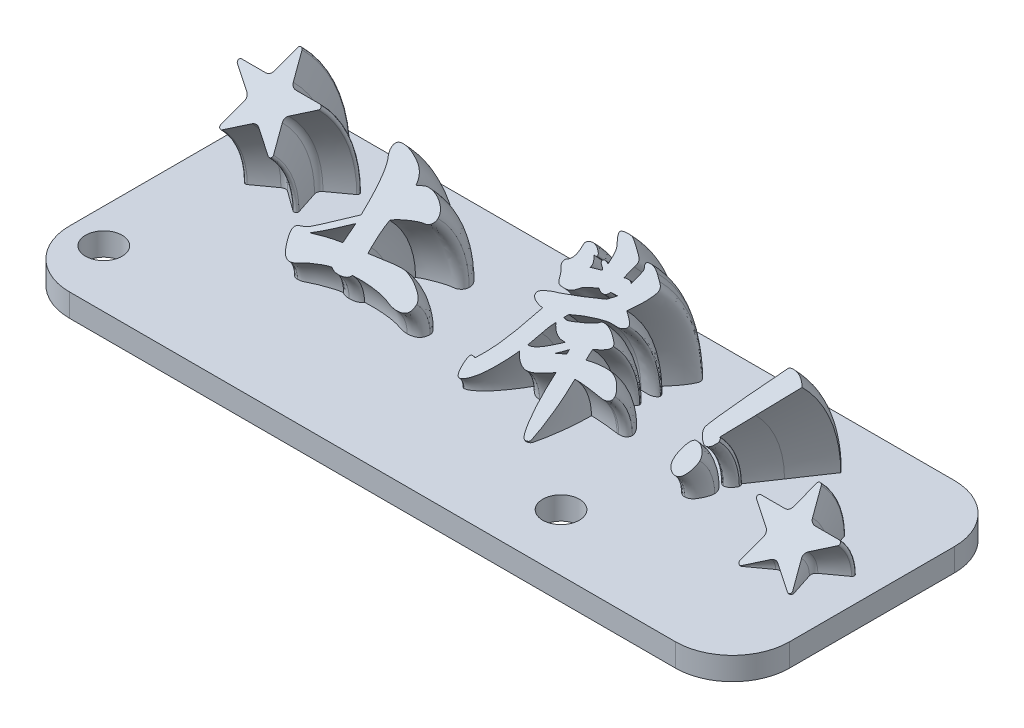
from build123d import *

# Parameters (mm, degrees)
SKETCH_1_W      = 63
SKETCH_1_H      = 24.41971005
SKETCH_1_R      = 1.6
EXTRUDE_1_DEPTH = 2
FILLET_1_R      = 5


with BuildPart() as part:
    # 草图1 → 凸台-拉伸1 (new body)
    with BuildSketch(Plane(origin=(0, 0, 0), x_dir=(1, 0, 0), z_dir=(0, 1, 0))):
        with Locations((14.983849876, -22.209855025)):
            Rectangle(SKETCH_1_W, SKETCH_1_H)
        with Locations(Location((-13.516150124, -29.41971005, 0), (0, 0, 270))):
            Circle(SKETCH_1_R, mode=Mode.SUBTRACT)
        with Locations(Location((26.483849876, -29.41971005, 0), (0, 0, 270))):
            Circle(SKETCH_1_R, mode=Mode.SUBTRACT)
    extrude(amount=EXTRUDE_1_DEPTH)

    # 扫描3: sweep along a path in 草图3
    with BuildLine(Plane(origin=(0, 0, 0), x_dir=(0, 0, -1), z_dir=(1, 0, 0))) as sweep_3_path:
        ThreePointArc((-10.91971005, 2), (-12.061517062, 7.740251485), (-15.313108332, 12.606601718))
    # 草图2 → 扫描3 (sweep)
    # profile 1 of 6: a face of its own
    with BuildSketch(Plane(origin=(0, 2, 0), x_dir=(1, 0, 0), z_dir=(0, 1, 0))):
        with BuildLine():
            Line((-12.181116617, -18.291213265), (-11.528669886, -16.283188703))
            ThreePointArc((-11.528669886, -16.283188703), (-11.528669886, -15.974171709), (-11.710305518, -15.724171709))
            Line((-11.710305518, -15.724171709), (-13.418433235, -14.483144279))
            ThreePointArc((-13.418433235, -14.483144279), (-13.491087488, -14.259537482), (-13.300876184, -14.121340881))
            Line((-13.300876184, -14.121340881), (-11.189514212, -14.121340881))
            ThreePointArc((-11.189514212, -14.121340881), (-10.895621586, -14.025849378), (-10.713985954, -13.775849378))
            Line((-10.713985954, -13.775849378), (-10.061539223, -11.767824816))
            ThreePointArc((-10.061539223, -11.767824816), (-9.87132792, -11.629628215), (-9.681116617, -11.767824816))
            Line((-9.681116617, -11.767824816), (-9.028669886, -13.775849378))
            ThreePointArc((-9.028669886, -13.775849378), (-8.847034254, -14.025849378), (-8.553141628, -14.121340881))
            Line((-8.553141628, -14.121340881), (-6.441779655, -14.121340881))
            ThreePointArc((-6.441779655, -14.121340881), (-6.251568352, -14.259537482), (-6.324222605, -14.483144279))
            Line((-6.324222605, -14.483144279), (-8.032350322, -15.724171709))
            ThreePointArc((-8.032350322, -15.724171709), (-8.213985954, -15.974171709), (-8.213985954, -16.283188703))
            Line((-8.213985954, -16.283188703), (-7.561539223, -18.291213265))
            ThreePointArc((-7.561539223, -18.291213265), (-7.634193476, -18.514820063), (-7.869307577, -18.514820063))
            Line((-7.869307577, -18.514820063), (-9.577435294, -17.273792634))
            ThreePointArc((-9.577435294, -17.273792634), (-9.87132792, -17.178301131), (-10.165220546, -17.273792634))
            Line((-10.165220546, -17.273792634), (-11.873348263, -18.514820063))
            ThreePointArc((-11.873348263, -18.514820063), (-12.108462364, -18.514820063), (-12.181116617, -18.291213265))
        make_face()
    # profile 2 of 6: a face of its own
    with BuildSketch(Plane(origin=(0, 2, 0), x_dir=(1, 0, 0), z_dir=(0, 1, 0))):
        with BuildLine():
            Line((22.091305848, -12.754817597), (22.548752657, -13.125030363))
            add(Edge.make_bspline(
                [(22.548752657, -13.125030363), (22.636654759, -13.195519199), (22.766563315, -13.29916809), (22.856934675, -13.480230515), (22.882961785, -13.612227973), (22.853142594, -13.760703594), (22.785567516, -13.935967708), (22.676609943, -14.148681957), (22.527450722, -14.397564759), (22.337237862, -14.681525565), (22.002537346, -15.125993706), (21.723446786, -15.469859045), (21.516837763, -15.703753767)],
                knots=[0, 0, 0, 0, 0.110126605, 0.153371671, 0.192108736, 0.236891976, 0.296350469, 0.37248426, 0.465912553, 0.574887644, 0.700458096, 1, 1, 1, 1], degree=3))
            add(Edge.make_bspline(
                [(21.516837763, -15.703753767), (21.623503315, -15.784597402), (21.773056818, -15.901070563), (21.952953682, -16.056053802), (22.053020221, -16.159271105), (22.133338608, -16.250624228), (22.205301615, -16.351116298), (22.237993014, -16.429683131), (22.238114359, -16.480349512)],
                knots=[0, 0, 0, 0, 0.371009584, 0.525656366, 0.657756634, 0.769305216, 0.862579579, 1, 1, 1, 1], degree=3))
            add(Edge.make_bspline(
                [(22.238114359, -16.480349512), (22.237580177, -16.53146243), (22.199090885, -16.608896689), (22.107473516, -16.690524496), (22.010128759, -16.752546088), (21.894515023, -16.808573158), (21.761792339, -16.84464893), (21.617142273, -16.870230125), (21.336991086, -16.87034432), (21.106478154, -16.859156989), (20.927476061, -16.861200576)],
                knots=[0, 0, 0, 0, 0.101429238, 0.168992905, 0.248462432, 0.33649523, 0.429917157, 0.528167805, 0.635288959, 1, 1, 1, 1], degree=3))
            add(Edge.make_bspline(
                [(20.927476061, -16.861200576), (20.84904701, -16.860791094), (20.722794143, -16.87431188), (20.541689616, -16.896600958), (20.378416985, -16.928693575), (20.195405821, -16.962840302), (19.995490244, -17.012020673), (19.776542337, -17.063840828), (19.466292463, -17.14586895), (19.080595941, -17.253802462), (18.509846159, -17.434087095), (18.103598545, -17.587891947), (17.846624997, -17.697370789)],
                knots=[0, 0, 0, 0, 0.073275516, 0.118825889, 0.17079738, 0.229012267, 0.293121427, 0.363506301, 0.439691932, 0.593575122, 0.738487947, 1, 1, 1, 1], degree=3))
            add(Edge.make_bspline(
                [(17.846624997, -17.697370789), (17.770706456, -17.804779182), (17.698995027, -17.91501391), (17.626299799, -18.024589214)],
                knots=[0, 0, 0, 0, 0.185269975, 0.185269975, 0.185269975, 0.185269975], degree=3))
            add(Edge.make_bspline(
                [(17.626299799, -18.024589214), (17.644281987, -18.02358186), (17.661518614, -18.022902703)],
                knots=[0.983400778, 0.983400778, 0.983400778, 1, 1, 1], degree=2))
            Line((17.661518614, -18.022902703), (17.859390955, -18.065455895))
            add(Edge.make_bspline(
                [(17.859390955, -18.065455895), (17.922472771, -18.06378806), (18.026550543, -18.047662863), (18.17740703, -18.014041892), (18.319603963, -17.972479573), (18.481863569, -17.920873565), (18.664708442, -17.859940167), (18.86677006, -17.783942489), (19.083057543, -17.702693659), (19.296794267, -17.615655628), (19.49475597, -17.532850612), (19.669830954, -17.456806367), (19.820360106, -17.385223582), (19.946734552, -17.318073096), (20.073653891, -17.248670518), (20.151481042, -17.189489542), (20.193433508, -17.150562278)],
                knots=[0, 0, 0, 0, 0.074782481, 0.124859091, 0.183531506, 0.250677228, 0.327139576, 0.412434862, 0.507097542, 0.601591364, 0.686553139, 0.762001582, 0.828323007, 0.884473345, 0.932019765, 1, 1, 1, 1], degree=3))
            add(Edge.make_bspline(
                [(20.193433508, -17.150562278), (20.317768429, -17.049770953), (20.478539891, -17.054817597)],
                knots=[0, 0, 0, 1, 1, 1], degree=2))
            add(Edge.make_bspline(
                [(20.478539891, -17.054817597), (20.647104926, -17.051991779), (20.903199954, -17.112912149), (21.228341174, -17.271906024), (21.428565294, -17.412373726), (21.584157971, -17.533852312), (21.686981178, -17.622778302), (21.776288915, -17.70314609), (21.846450217, -17.780239575), (21.902239963, -17.850375356), (21.954473695, -17.928438107), (21.974091898, -17.990583107), (21.976412231, -18.029285682)],
                knots=[0, 0, 0, 0, 0.267581639, 0.415335096, 0.577184528, 0.658037541, 0.731305499, 0.794770106, 0.850213624, 0.897909293, 0.938224058, 1, 1, 1, 1], degree=3))
            add(Edge.make_bspline(
                [(21.976412231, -18.029285682), (21.975602774, -18.096574855), (21.917100795, -18.193684463), (21.798833756, -18.309036491), (21.661375316, -18.406446857), (21.486567414, -18.506561605), (21.182204327, -18.659925022), (20.927711224, -18.760583366), (20.746624997, -18.831413342)],
                knots=[0, 0, 0, 0, 0.127558201, 0.216833012, 0.326261833, 0.459551721, 0.615138123, 1, 1, 1, 1], degree=3))
            add(Edge.make_bspline(
                [(20.746624997, -18.831413342), (20.729537527, -18.928481732), (20.710002013, -19.188192824), (20.70500225, -19.448337123), (20.706199465, -19.610136746)],
                knots=[0, 0, 0, 0, 0.378279263, 1, 1, 1, 1], degree=3))
            add(Edge.make_bspline(
                [(20.706199465, -19.610136746), (20.990542604, -19.546590225), (21.414444073, -19.48138766), (21.974265124, -19.429166824), (22.308923323, -19.420857218), (22.566541777, -19.425228191), (22.745670934, -19.450206884), (22.914417923, -19.485161368), (23.070389118, -19.538366648), (23.215331754, -19.605051827), (23.348775549, -19.685546096), (23.467839012, -19.784969961), (23.606566657, -19.927880391), (23.747908676, -20.108179222), (23.908684519, -20.360469753), (23.980865444, -20.554173856), (23.98279521, -20.678221852)],
                knots=[0, 0, 0, 0, 0.223305433, 0.328703138, 0.431010523, 0.479997342, 0.526083135, 0.569510907, 0.612001824, 0.652161837, 0.691720474, 0.731144225, 0.770766398, 0.844340706, 0.906387243, 1, 1, 1, 1], degree=3))
            add(Edge.make_bspline(
                [(23.98279521, -20.678221852), (23.982613435, -20.75434176), (23.967050725, -20.868634741), (23.890114278, -20.993483555), (23.815116355, -21.068946067), (23.716861585, -21.126195957), (23.547275646, -21.182743868), (23.405064269, -21.191699677), (23.306199465, -21.193115469)],
                knots=[0, 0, 0, 0, 0.238234253, 0.343709532, 0.44932194, 0.564588411, 0.692398315, 1, 1, 1, 1], degree=3))
            add(Edge.make_bspline(
                [(23.306199465, -21.193115469), (23.221576785, -21.19218932), (23.138114359, -21.178221852)],
                knots=[0, 0, 0, 1, 1, 1], degree=2))
            add(Edge.make_bspline(
                [(23.138114359, -21.178221852), (22.975549397, -21.146232865), (22.700544337, -21.113685271), (22.296586276, -21.06877213), (21.927628594, -21.035328758), (21.558227452, -21.003867324), (21.149113694, -20.977379904), (20.868710307, -20.968078567), (20.699816487, -20.971838874)],
                knots=[0, 0, 0, 0, 0.20275136, 0.339071354, 0.497863557, 0.656503611, 0.793166396, 1, 1, 1, 1], degree=3))
            add(Edge.make_bspline(
                [(20.699816487, -20.971838874), (20.696870644, -21.285402165), (20.686301385, -21.742565715), (20.650394646, -22.333083353), (20.619360678, -22.743332418), (20.573837823, -23.148708728), (20.524909741, -23.567067863), (20.456763511, -24.004140809), (20.395731919, -24.376936833), (20.347185925, -24.67020228), (20.307386279, -24.868961568), (20.273385525, -25.044845384), (20.245056263, -25.198644448), (20.21461487, -25.328899269), (20.187524678, -25.435986752), (20.163921994, -25.520574924), (20.138657096, -25.600700246), (20.091718155, -25.678739187), (19.96813795, -25.770781119), (19.844717084, -25.782259409), (19.763646274, -25.784604831)],
                knots=[0, 0, 0, 0, 0.183984559, 0.268181079, 0.347067651, 0.425318523, 0.507479492, 0.594157246, 0.684792239, 0.72911804, 0.768531687, 0.803702217, 0.834221122, 0.860261937, 0.882160604, 0.899020868, 0.911784451, 0.931410949, 0.951300313, 1, 1, 1, 1], degree=3))
            add(Edge.make_bspline(
                [(19.763646274, -25.784604831), (19.710224662, -25.785291315), (19.630565063, -25.743768657), (19.55275618, -25.643786226), (19.493934175, -25.536578354), (19.441403139, -25.399579648), (19.393278052, -25.232905539), (19.349831731, -25.035870875), (19.296022907, -24.73274755), (19.246269721, -24.328746138), (19.198287567, -23.83147906), (19.170542393, -23.32394253), (19.164448293, -22.818665246), (19.166421934, -22.337751817), (19.177278762, -21.800679031), (19.19034738, -21.427497631), (19.208327125, -21.199498448)],
                knots=[0, 0, 0, 0, 0.032670432, 0.053646159, 0.079297049, 0.109635706, 0.1460356, 0.188711511, 0.236914469, 0.340293257, 0.445496153, 0.5521864, 0.660970635, 0.764369771, 0.855699989, 1, 1, 1, 1], degree=3))
            add(Edge.make_bspline(
                [(19.208327125, -21.199498448), (18.996505427, -21.320546702), (18.693681444, -21.498003724), (18.290590459, -21.689891367), (18.028010299, -21.807172357), (17.786404042, -21.894100543), (17.514425851, -21.976558398), (17.317236418, -22.009560463), (17.193433508, -22.010136746)],
                knots=[0, 0, 0, 0, 0.33427401, 0.479765057, 0.611093469, 0.727817969, 0.83105706, 1, 1, 1, 1], degree=3))
            add(Edge.make_bspline(
                [(17.193433508, -22.010136746), (17.044378813, -22.011442926), (16.819744232, -21.958184852), (16.547308674, -21.804297983), (16.361111404, -21.645141134), (16.198790879, -21.476250939), (16.078654855, -21.318352663), (16.02263732, -21.214198904), (16.005462488, -21.168476155)],
                knots=[0, 0, 0, 0, 0.26487199, 0.404536003, 0.555847981, 0.701142983, 0.822619503, 0.910137352, 0.910137352, 0.910137352, 0.910137352], degree=3))
            add(Edge.make_bspline(
                [(16.005462488, -21.168476155), (15.933195988, -21.298356507), (15.734378794, -21.64231384), (15.460587706, -22.081246459), (15.189929912, -22.479517996), (14.993913369, -22.75546415), (14.807959991, -23.012197581), (14.625020377, -23.243273189), (14.44919086, -23.452127218), (14.284987506, -23.643120153), (14.123396322, -23.808289825), (13.969330575, -23.951620062), (13.824309144, -24.075624004), (13.68759143, -24.182237649), (13.560997284, -24.273850186), (13.443910655, -24.348601084), (13.336714791, -24.408413168), (13.212373201, -24.457811786), (13.12167446, -24.48248118), (13.063646274, -24.482477171)],
                knots=[0.285582836, 0.285582836, 0.285582836, 0.285582836, 0.355951056, 0.473628688, 0.530443117, 0.583923532, 0.633894059, 0.68051764, 0.723427035, 0.763166997, 0.799737274, 0.832764073, 0.862776763, 0.890049343, 0.914837504, 0.936729248, 0.955811073, 0.972834715, 1, 1, 1, 1], degree=3))
            add(Edge.make_bspline(
                [(13.063646274, -24.482477171), (13.017589254, -24.485706543), (12.949421468, -24.455084847), (12.888250075, -24.374949174), (12.847595015, -24.292929921), (12.820447598, -24.186353168), (12.785358195, -24.001432627), (12.784780928, -23.848199512), (12.78279521, -23.73992398)],
                knots=[0, 0, 0, 0, 0.155982349, 0.241795894, 0.346475975, 0.472038898, 0.622337617, 1, 1, 1, 1], degree=3))
            add(Edge.make_bspline(
                [(12.78279521, -23.73992398), (12.785015902, -23.613239378), (12.784950653, -23.434618891), (12.820786258, -23.217866625), (12.846717311, -23.093472595), (12.888284535, -22.997787298), (12.946149479, -22.905794606), (13.015354562, -22.866392132), (13.063646274, -22.869711214)],
                knots=[0, 0, 0, 0, 0.388213482, 0.541688272, 0.670919341, 0.774725337, 0.858834364, 1, 1, 1, 1], degree=3))
            add(Edge.make_bspline(
                [(13.063646274, -22.869711214), (13.133104962, -22.873785444), (13.224157041, -22.871808419), (13.314999062, -22.905685827), (13.333200934, -22.921698663), (13.334916387, -22.923324956)],
                knots=[0, 0, 0, 0, 0.396090859, 0.521279296, 0.534791128, 0.534791128, 0.534791128, 0.534791128], degree=3))
            add(Edge.make_bspline(
                [(13.334916387, -22.923324956), (13.343899124, -22.912633225), (13.383857302, -22.864098926), (13.458491727, -22.763617569), (13.569817464, -22.614609101), (13.701722748, -22.432525164), (13.849619536, -22.21378657), (14.022212084, -21.962422574), (14.211874426, -21.66773749), (14.407210458, -21.318994645), (14.620441021, -20.920562836), (14.84804803, -20.469984733), (15.085462794, -19.96481852), (15.433367315, -19.188821605), (15.696833685, -18.578750233), (15.872156912, -18.152689937)],
                knots=[0.031545124, 0.031545124, 0.031545124, 0.031545124, 0.039044058, 0.065343187, 0.098482233, 0.138772681, 0.185786055, 0.239964126, 0.30216394, 0.373482291, 0.454071252, 0.544317996, 0.643936129, 0.75313668, 1, 1, 1, 1], degree=3))
            add(Edge.make_bspline(
                [(15.872156912, -18.152689937), (15.724027515, -18.130139047), (15.513972892, -18.099242793), (15.264400547, -18.01529276), (15.120108154, -17.953497949), (15.006284305, -17.881610071), (14.900259995, -17.775590413), (14.857790763, -17.674672855), (14.861518614, -17.605881427)],
                knots=[0, 0, 0, 0, 0.365187915, 0.512324759, 0.638830944, 0.745896882, 0.837296112, 1, 1, 1, 1], degree=3))
            add(Edge.make_bspline(
                [(14.861518614, -17.605881427), (14.863662049, -17.516097602), (14.947784843, -17.387204381), (15.132931003, -17.264134231), (15.32713561, -17.168795832), (15.54302298, -17.083527837), (15.756264035, -17.005847711), (15.956907472, -16.943254321), (16.122961589, -16.905429461), (16.262660486, -16.875092559), (16.389651156, -16.842365121), (16.539132387, -16.799852924), (16.712675284, -16.748034468), (16.90995063, -16.688825859), (17.130571951, -16.620897534), (17.374665049, -16.543945022), (18.255056339, -16.256235401), (19.050951791, -15.982656319), (19.748752657, -15.714392065)],
                knots=[0, 0, 0, 0, 0.048491233, 0.081972573, 0.12449083, 0.170185603, 0.21264189, 0.252319931, 0.288460003, 0.308520986, 0.332839239, 0.362305092, 0.396052274, 0.43484985, 0.478316434, 0.526072239, 0.579002596, 1, 1, 1, 1], degree=3))
            add(Edge.make_bspline(
                [(19.748752657, -15.714392065), (20.0621747, -15.460009706), (20.357263295, -15.184604831)],
                knots=[0, 0, 0, 1, 1, 1], degree=2))
            add(Edge.make_bspline(
                [(20.357263295, -15.184604831), (20.327267183, -15.191796814), (20.268270345, -15.199011718), (20.17072522, -15.199114945), (20.066506433, -15.202627295), (19.960777018, -15.200582312), (19.860763278, -15.204348508), (19.798136267, -15.20456662), (19.765773934, -15.210136746)],
                knots=[0, 0, 0, 0, 0.155970367, 0.299577126, 0.493418923, 0.683638443, 0.834421161, 1, 1, 1, 1], degree=3))
            add(Edge.make_bspline(
                [(19.765773934, -15.210136746), (19.719089889, -15.302073469), (19.626328599, -15.425314491), (19.450766019, -15.51878475), (19.311960624, -15.533471924), (19.176476641, -15.523353475), (19.006245859, -15.477283687), (18.893653869, -15.40979375), (18.829603721, -15.352689937)],
                knots=[0, 0, 0, 0, 0.279858394, 0.402462577, 0.526363878, 0.651343181, 0.768537128, 1, 1, 1, 1], degree=3))
            add(Edge.make_bspline(
                [(18.829603721, -15.352689937), (18.644251901, -15.420932637), (18.395559115, -15.524139868), (18.094824698, -15.64226773), (17.897634355, -15.72966946), (17.686116482, -15.846979521), (17.480609361, -16.038623264), (17.278372704, -16.223681465), (17.08393641, -16.329179441), (16.92284088, -16.381082207), (16.792455014, -16.409266038), (16.649040982, -16.421915554), (16.500491601, -16.429892797), (16.357746904, -16.422075544), (16.232063742, -16.410779255), (16.130914865, -16.382212574), (16.044994061, -16.346269745), (15.977678115, -16.279321086), (15.918646525, -16.186595921), (15.862087696, -16.063804328), (15.811090602, -15.918028349), (15.765555159, -15.766439372), (15.70328331, -15.634423554), (15.644675112, -15.521085823), (15.523476577, -15.373213536), (15.436289533, -15.246872756), (15.438114359, -15.127158023)],
                knots=[0, 0, 0, 0, 0.133001137, 0.181444552, 0.217586547, 0.278391937, 0.343119869, 0.406191934, 0.46262796, 0.490278001, 0.520077777, 0.552264031, 0.587172233, 0.620170975, 0.648558371, 0.671857738, 0.690879591, 0.710486505, 0.734604317, 0.764739275, 0.801314499, 0.838634248, 0.871138103, 0.899585748, 0.924144404, 1, 1, 1, 1], degree=3))
            add(Edge.make_bspline(
                [(15.438114359, -15.127158023), (15.437466259, -15.05127284), (15.457569634, -14.93809127), (15.549454555, -14.820532449), (15.645445978, -14.769971336), (15.747876698, -14.717714959), (15.838912932, -14.629966785), (15.925180532, -14.522773501), (16.00192914, -14.38799893), (16.069322711, -14.224579987), (16.132947345, -13.940772792), (16.145161453, -13.708524673), (16.144497338, -13.544179299)],
                knots=[0, 0, 0, 0, 0.124995936, 0.180308523, 0.237667531, 0.300608383, 0.368017971, 0.442370998, 0.525621772, 0.620932107, 0.73077443, 1, 1, 1, 1], degree=3))
            add(Edge.make_bspline(
                [(16.144497338, -13.544179299), (16.14371459, -13.471342009), (16.160114772, -13.36114028), (16.243307681, -13.246493134), (16.354625444, -13.165836573), (16.526292279, -13.108499642), (16.712166952, -13.084525192), (16.871291572, -13.099613026), (16.996264347, -13.141075835), (17.125375536, -13.202070078), (17.245880181, -13.29007736), (17.352827939, -13.381369636), (17.439613552, -13.463659409), (17.489294028, -13.542207662), (17.510702792, -13.611479574), (17.501497574, -13.667728447), (17.477072424, -13.711583843), (17.430879787, -13.736132367), (17.362368173, -13.741649428), (17.304192366, -13.741522123), (17.267473588, -13.728426765), (17.263159408, -13.726552499)],
                knots=[0, 0, 0, 0, 0.099839376, 0.143840496, 0.188414638, 0.283871586, 0.385395448, 0.440454492, 0.498793151, 0.562811043, 0.633167727, 0.699958167, 0.753625235, 0.794154711, 0.82491022, 0.849231699, 0.869496437, 0.890586822, 0.91680721, 0.962120541, 0.968378571, 0.968378571, 0.968378571, 0.968378571], degree=3))
            add(Edge.make_bspline(
                [(17.263159408, -13.726552499), (17.293017142, -13.775269255), (17.356192296, -13.87931104), (17.436281766, -14.033161911), (17.491075699, -14.180590234), (17.508855899, -14.302368142), (17.505841939, -14.395983224), (17.489632304, -14.461981535), (17.467463137, -14.504432353), (17.448472018, -14.516099829), (17.441764449, -14.518330616)],
                knots=[0.067600269, 0.067600269, 0.067600269, 0.067600269, 0.247993662, 0.451212436, 0.614741941, 0.741367831, 0.837725266, 0.907225464, 0.957528385, 0.979753835, 0.979753835, 0.979753835, 0.979753835], degree=3))
            add(Edge.make_bspline(
                [(17.441764449, -14.518330616), (17.47560506, -14.513448151), (17.508430914, -14.504333873), (17.540242019, -14.49098781)],
                knots=[0.16832083, 0.16832083, 0.16832083, 0.16832083, 1, 1, 1, 1], degree=3))
            add(Edge.make_bspline(
                [(17.540242019, -14.49098781), (17.948571377, -14.370009524), (18.367901593, -14.295243129)],
                knots=[0, 0, 0, 1, 1, 1], degree=2))
            add(Edge.make_bspline(
                [(18.367901593, -14.295243129), (18.353792377, -14.247269125), (18.290321586, -14.147498598), (18.194302065, -14.07934071), (18.140242019, -14.04205164)],
                knots=[0, 0, 0, 0, 0.428422857, 1, 1, 1, 1], degree=3))
            add(Edge.make_bspline(
                [(18.140242019, -14.04205164), (18.095183484, -14.009151534), (18.032831285, -13.957386165), (17.986516192, -13.867696343), (17.975453731, -13.806304665), (17.983176121, -13.747553498), (18.042661775, -13.684426239), (18.113023404, -13.679953651), (18.157263295, -13.678221852)],
                knots=[0, 0, 0, 0, 0.310300554, 0.43246365, 0.547301734, 0.650622115, 0.744603316, 1, 1, 1, 1], degree=3))
            add(Edge.make_bspline(
                [(18.157263295, -13.678221852), (18.343285391, -13.689665142), (18.508327125, -13.778221852)],
                knots=[0, 0, 0, 1, 1, 1], degree=2))
            add(Edge.make_bspline(
                [(18.508327125, -13.778221852), (18.522060343, -13.569957604), (18.528641889, -13.313857071), (18.527001939, -13.017082274), (18.518567874, -12.894154661), (18.50482296, -12.790034758), (18.481989014, -12.697999759), (18.447395447, -12.605401214), (18.391167416, -12.50232893), (18.323302774, -12.375906273), (18.232419559, -12.242419488), (18.147320412, -12.103019163), (18.084394648, -11.967373131), (18.048021993, -11.844044494), (18.030982629, -11.749540114), (18.04242539, -11.677896521), (18.080574504, -11.634289404), (18.137193011, -11.598766062), (18.216421336, -11.573327357), (18.314224233, -11.54898437), (18.488832496, -11.531148209), (18.6299118, -11.521499039), (18.73173138, -11.525030363)],
                knots=[0, 0, 0, 0, 0.213269632, 0.261848041, 0.303272963, 0.339157153, 0.369048437, 0.400019174, 0.439899121, 0.488908389, 0.546624389, 0.604811992, 0.65575114, 0.698873153, 0.736101622, 0.753165392, 0.77071506, 0.793235858, 0.82098432, 0.855273184, 0.896187456, 1, 1, 1, 1], degree=3))
            add(Edge.make_bspline(
                [(18.73173138, -11.525030363), (18.825804119, -11.5246999), (18.960415216, -11.533962525), (19.123871287, -11.583931997), (19.225873626, -11.640316697), (19.330390162, -11.714987426), (19.457291391, -11.802708398), (19.609814319, -11.912624536), (19.778485722, -12.037609967), (19.947196391, -12.163454725), (20.092264425, -12.283227987), (20.208299601, -12.385936866), (20.294034179, -12.477538469), (20.356470762, -12.558624459), (20.400220042, -12.63347045), (20.427291007, -12.704622499), (20.436797298, -12.774641808), (20.427736387, -12.84698972), (20.402790608, -12.964514325), (20.368713438, -13.056309004), (20.342369678, -13.120775044)],
                knots=[0, 0, 0, 0, 0.110130473, 0.156266043, 0.198539266, 0.245669331, 0.306376442, 0.378836503, 0.465374817, 0.551746245, 0.624763591, 0.685204156, 0.732711731, 0.771172433, 0.804585925, 0.833691535, 0.859600047, 0.886240729, 0.918428867, 1, 1, 1, 1], degree=3))
            add(Edge.make_bspline(
                [(20.342369678, -13.120775044), (20.224550252, -13.423300892), (20.138412026, -13.734513203), (20.083958547, -14.054391141)],
                knots=[0, 0, 0, 0, 0.980016531, 0.980016531, 0.980016531, 0.980016531], degree=3))
            add(Edge.make_bspline(
                [(20.083958547, -14.054391141), (20.086896891, -14.045466275), (20.103305792, -14.019341259), (20.168022149, -13.992456003), (20.268169025, -13.979764354), (20.397242372, -13.973337683), (20.528877817, -13.982066653), (20.666759619, -14.011091097), (20.743160481, -14.074141907), (20.755135636, -14.131413342)],
                knots=[0.023619821, 0.023619821, 0.023619821, 0.023619821, 0.059308951, 0.146768419, 0.275323574, 0.457232234, 0.644965408, 0.787209926, 1, 1, 1, 1], degree=3))
            add(Edge.make_bspline(
                [(20.755135636, -14.131413342), (20.80390375, -13.991404247), (20.870627394, -13.793800653), (20.951307256, -13.546163619), (20.994878772, -13.397392279), (21.032482645, -13.273832364), (21.057666701, -13.174457033), (21.074400717, -13.0999893), (21.081665671, -13.014392432), (21.07310972, -12.914723841), (21.011706392, -12.815019219), (20.957680748, -12.714279741), (20.938756776, -12.611585283), (20.966733059, -12.517956972), (21.049087978, -12.472815072), (21.163171313, -12.449805293), (21.315874898, -12.442265843), (21.496220503, -12.460437481), (21.771187473, -12.544081004), (21.963077412, -12.665768), (22.091305848, -12.754817597)],
                knots=[0, 0, 0, 0, 0.153902028, 0.216536547, 0.27034441, 0.314844337, 0.350558907, 0.376838532, 0.393836542, 0.439863443, 0.477072178, 0.513951658, 0.558518534, 0.582044493, 0.609612696, 0.649791482, 0.70361949, 0.76728411, 0.837171184, 1, 1, 1, 1], degree=3))
        make_face()
        with BuildLine():
            add(Edge.make_bspline(
                [(16.778539891, -19.533541001), (16.631367712, -19.893022224), (16.475212851, -20.249496749), (16.303859142, -20.598372909)],
                knots=[0, 0, 0, 0, 0.184016793, 0.184016793, 0.184016793, 0.184016793], degree=3))
            add(Edge.make_bspline(
                [(16.303859142, -20.598372909), (16.309588901, -20.597237311), (16.349715386, -20.589950947), (16.430358429, -20.584460824), (16.549658448, -20.574894796), (16.680915702, -20.539488728), (16.825194358, -20.490651815), (16.982806045, -20.424723255), (17.150750208, -20.337936261), (17.332592539, -20.235275454), (17.527051235, -20.11455859), (17.727084655, -19.979010613), (17.921952307, -19.843979524), (18.098910392, -19.71695896), (18.254160237, -19.608173059), (18.383237252, -19.511206992), (18.491348315, -19.43331021), (18.58617616, -19.357119085), (18.645887396, -19.307483964), (18.674284572, -19.276094193)],
                knots=[0.176080369, 0.176080369, 0.176080369, 0.176080369, 0.181320567, 0.212675555, 0.248528747, 0.288517677, 0.334215059, 0.385289426, 0.441659288, 0.503801242, 0.572697449, 0.647028948, 0.720667549, 0.785493757, 0.8425496, 0.890804793, 0.93040164, 0.962116451, 1, 1, 1, 1], degree=3))
            add(Edge.make_bspline(
                [(18.674284572, -19.276094193), (18.569679826, -19.292691965), (18.463646274, -19.29098781)],
                knots=[0, 0, 0, 1, 1, 1], degree=2))
            add(Edge.make_bspline(
                [(18.463646274, -19.29098781), (18.311660594, -19.292297109), (18.083467983, -19.248262601), (17.809818107, -19.104437344), (17.63000157, -18.956379053), (17.480144912, -18.793282784), (17.370531645, -18.643611932), (17.324790128, -18.544650855), (17.310392365, -18.504453712)],
                knots=[0, 0, 0, 0, 0.20514862, 0.308147884, 0.415282414, 0.518482566, 0.607378891, 0.665013003, 0.665013003, 0.665013003, 0.665013003], degree=3))
            add(Edge.make_bspline(
                [(17.310392365, -18.504453712), (17.292679913, -18.532587435), (17.253632441, -18.594725627), (17.195854233, -18.686043043), (17.015191968, -18.989936164), (16.882544576, -19.275232444), (16.778539891, -19.533541001)],
                knots=[0.455102362, 0.455102362, 0.455102362, 0.455102362, 0.501942603, 0.558503644, 0.607344045, 1, 1, 1, 1], degree=3))
        make_face(mode=Mode.SUBTRACT)
        with BuildLine():
            add(Edge.make_bspline(
                [(19.208327125, -19.884604831), (19.20803849, -19.723890157), (19.214710104, -19.563328235)],
                knots=[0, 0, 0, 1, 1, 1], degree=2))
            add(Edge.make_bspline(
                [(19.214710104, -19.563328235), (19.041685362, -19.718212108), (18.784186579, -19.931816438), (18.51457548, -20.131663629), (18.429422824, -20.190454802), (18.428268864, -20.191250746)],
                knots=[0, 0, 0, 0, 0.340856628, 0.490553636, 0.492611071, 0.492611071, 0.492611071, 0.492611071], degree=3))
            add(Edge.make_bspline(
                [(18.428268864, -20.191250746), (18.448575709, -20.183371266), (18.709005487, -20.082206303), (18.968571114, -19.978823609), (19.208327125, -19.884604831)],
                knots=[0.538276608, 0.538276608, 0.538276608, 0.538276608, 0.574273912, 1, 1, 1, 1], degree=3))
        make_face(mode=Mode.SUBTRACT)
    # profile 3 of 6: a face of its own
    with BuildSketch(Plane(origin=(0, 2, 0), x_dir=(1, 0, 0), z_dir=(0, 1, 0))):
        with BuildLine():
            Line((35.917263295, -14.382477171), (33.934284572, -17.318647384))
            add(Edge.make_bspline(
                [(33.934284572, -17.318647384), (33.657295719, -17.722616107), (33.135638237, -18.475501926), (32.632087938, -19.240597694), (32.395986699, -19.595243129)],
                knots=[0, 0, 0, 0, 0.534812103, 1, 1, 1, 1], degree=3))
            add(Edge.make_bspline(
                [(32.395986699, -19.595243129), (32.44240636, -19.594305906), (32.526469071, -19.680276356), (32.519820324, -19.797368646), (32.525773934, -19.861200576)],
                knots=[0, 0, 0, 0, 0.386733567, 1, 1, 1, 1], degree=3))
            add(Edge.make_bspline(
                [(32.525773934, -19.861200576), (32.519314368, -19.913294903), (32.47952018, -20.000486611), (32.391250042, -20.119141985), (32.301888568, -20.24106247), (32.192299819, -20.357378157), (32.030539384, -20.475312078), (31.887173132, -20.513171032), (31.79385904, -20.512264406)],
                knots=[0, 0, 0, 0, 0.149930835, 0.27206396, 0.426887733, 0.586196984, 0.731649796, 1, 1, 1, 1], degree=3))
            add(Edge.make_bspline(
                [(31.79385904, -20.512264406), (31.70780615, -20.510678336), (31.577196375, -20.453978215), (31.420892511, -20.321749142), (31.294944961, -20.183568266), (31.179993212, -20.030695235), (31.072027745, -19.833677762), (31.027409965, -19.680490268), (31.027901593, -19.580349512)],
                knots=[0, 0, 0, 0, 0.196984687, 0.323024397, 0.476637449, 0.633075827, 0.768768096, 1, 1, 1, 1], degree=3))
            add(Edge.make_bspline(
                [(31.027901593, -19.580349512), (31.033612835, -19.51922152), (31.075087762, -19.412084161), (31.148386837, -19.244339467), (31.237706661, -19.057201263), (31.356627524, -18.832649853), (31.495941946, -18.566421585), (31.662633974, -18.261423155), (31.857204131, -17.918066148), (32.072696453, -17.531987855), (32.318616509, -17.110095154), (32.587062638, -16.646364101), (32.881363397, -16.143789531), (33.205045856, -15.603081417), (33.677604813, -14.797994006), (34.054146058, -14.179631064), (34.310880317, -13.752689937)],
                knots=[0, 0, 0, 0, 0.02722793, 0.051132759, 0.082112919, 0.12005438, 0.164964858, 0.216717467, 0.275751969, 0.34176124, 0.414784788, 0.494508713, 0.581802589, 0.675685915, 0.776817463, 1, 1, 1, 1], degree=3))
            add(Edge.make_bspline(
                [(34.310880317, -13.752689937), (34.473981339, -13.687885398), (34.649178189, -13.684604831)],
                knots=[0, 0, 0, 1, 1, 1], degree=2))
            add(Edge.make_bspline(
                [(34.649178189, -13.684604831), (34.770574957, -13.685092657), (34.952949819, -13.703434347), (35.182924866, -13.779548083), (35.347275526, -13.855451658), (35.502036867, -13.955724589), (35.704730631, -14.120040534), (35.836345581, -14.272354754), (35.917263295, -14.382477171)],
                knots=[0, 0, 0, 0, 0.242276926, 0.361119487, 0.481206769, 0.601915731, 0.727463546, 1, 1, 1, 1], degree=3))
        make_face()
    # profile 4 of 6: a face of its own
    with BuildSketch(Plane(origin=(0, 2, 0), x_dir=(1, 0, 0), z_dir=(0, 1, 0))):
        with BuildLine():
            Line((38.392477816, -25.576319648), (39.044924546, -23.568295086))
            ThreePointArc((39.044924546, -23.568295086), (39.044924546, -23.259278092), (38.863288914, -23.009278092))
            Line((38.863288914, -23.009278092), (37.155161198, -21.768250662))
            ThreePointArc((37.155161198, -21.768250662), (37.082506945, -21.544643865), (37.272718248, -21.406447264))
            Line((37.272718248, -21.406447264), (39.38408022, -21.406447264))
            ThreePointArc((39.38408022, -21.406447264), (39.677972847, -21.310955761), (39.859608479, -21.060955761))
            Line((39.859608479, -21.060955761), (40.512055209, -19.052931199))
            ThreePointArc((40.512055209, -19.052931199), (40.702266512, -18.914734598), (40.892477816, -19.052931199))
            Line((40.892477816, -19.052931199), (41.544924546, -21.060955761))
            ThreePointArc((41.544924546, -21.060955761), (41.726560178, -21.310955761), (42.020452805, -21.406447264))
            Line((42.020452805, -21.406447264), (44.131814777, -21.406447264))
            ThreePointArc((44.131814777, -21.406447264), (44.32202608, -21.544643865), (44.249371827, -21.768250662))
            Line((44.249371827, -21.768250662), (42.541244111, -23.009278092))
            ThreePointArc((42.541244111, -23.009278092), (42.359608479, -23.259278092), (42.359608479, -23.568295086))
            Line((42.359608479, -23.568295086), (43.012055209, -25.576319648))
            ThreePointArc((43.012055209, -25.576319648), (42.939400956, -25.799926446), (42.704286856, -25.799926446))
            Line((42.704286856, -25.799926446), (40.996159139, -24.558899017))
            ThreePointArc((40.996159139, -24.558899017), (40.702266512, -24.463407514), (40.408373886, -24.558899017))
            Line((40.408373886, -24.558899017), (38.700246169, -25.799926446))
            ThreePointArc((38.700246169, -25.799926446), (38.465132069, -25.799926446), (38.392477816, -25.576319648))
        make_face()
    # profile 5 of 6: a face of its own
    with BuildSketch(Plane(origin=(0, 2, 0), x_dir=(1, 0, 0), z_dir=(0, 1, 0))):
        with BuildLine():
            add(Edge.make_bspline(
                [(2.352582444, -20.63779632), (2.689271347, -20.597807353), (3.167176364, -20.543654245), (3.768709039, -20.479195352), (4.139097076, -20.444153794), (4.455123904, -20.412240684), (4.768026456, -20.390967821), (4.975046855, -20.376558502), (5.095135636, -20.376094193)],
                knots=[0, 0, 0, 0, 0.369104147, 0.523602367, 0.658584971, 0.774132464, 0.869352909, 1, 1, 1, 1], degree=3))
            add(Edge.make_bspline(
                [(5.095135636, -20.376094193), (5.223069999, -20.378469169), (5.418140004, -20.390394557), (5.67406541, -20.449286546), (5.870780459, -20.505939976), (6.068307136, -20.581959189), (6.2694748, -20.669878118), (6.469189518, -20.781167732), (6.668674151, -20.900633154), (6.856453397, -21.027462606), (7.023357072, -21.155486172), (7.16577626, -21.279594055), (7.283742982, -21.401496819), (7.372466803, -21.522491455), (7.458747638, -21.671466241), (7.488219827, -21.791915902), (7.488752657, -21.869711214)],
                knots=[0, 0, 0, 0, 0.128375231, 0.194548466, 0.262645174, 0.333219063, 0.40634146, 0.482295967, 0.56195551, 0.639174585, 0.709066168, 0.772471627, 0.828236925, 0.878522838, 0.922396276, 1, 1, 1, 1], degree=3))
            add(Edge.make_bspline(
                [(7.488752657, -21.869711214), (7.486357924, -22.008870375), (7.465957835, -22.214965325), (7.346588277, -22.449227342), (7.227248391, -22.58775937), (7.069997942, -22.690449104), (6.805331094, -22.796791925), (6.57879749, -22.815350189), (6.42279521, -22.816519725)],
                knots=[0, 0, 0, 0, 0.258327563, 0.369682008, 0.478700004, 0.590420096, 0.711455996, 1, 1, 1, 1], degree=3))
            add(Edge.make_bspline(
                [(6.42279521, -22.816519725), (6.271755493, -22.818605505), (6.045664822, -22.791061422), (5.746336208, -22.722433195), (5.51921989, -22.639974806), (5.273365602, -22.550756144), (4.990229198, -22.48453317), (4.671096701, -22.421956597), (4.322744405, -22.374127728), (3.965759848, -22.335161412), (3.617546549, -22.304072244), (3.28679492, -22.287317938), (2.979564164, -22.281845735), (2.707870191, -22.2811629), (2.441902501, -22.287603374), (2.268045524, -22.290192919), (2.169603721, -22.297370789)],
                knots=[0, 0, 0, 0, 0.104785204, 0.158053963, 0.213302377, 0.272765546, 0.339915856, 0.415315509, 0.499069567, 0.584472302, 0.665213138, 0.742304289, 0.814867647, 0.879025965, 0.931348981, 1, 1, 1, 1], degree=3))
            add(Edge.make_bspline(
                [(2.169603721, -22.297370789), (2.135218855, -22.363619256), (2.059412392, -22.448459931), (1.935684597, -22.540438417), (1.82205506, -22.592624869), (1.694178667, -22.634494595), (1.492908454, -22.680561268), (1.330495676, -22.683939264), (1.218539891, -22.686732491)],
                knots=[0, 0, 0, 0, 0.205635643, 0.313013215, 0.426887226, 0.551711118, 0.687218361, 1, 1, 1, 1], degree=3))
            add(Edge.make_bspline(
                [(1.218539891, -22.686732491), (1.083959192, -22.686989012), (0.836764579, -22.661701094), (0.609372111, -22.558233435), (0.52492287, -22.484604831)],
                knots=[0, 0, 0, 0, 0.548932302, 1, 1, 1, 1], degree=3))
            add(Edge.make_bspline(
                [(0.52492287, -22.484604831), (0.363288022, -22.507285469), (0.100752802, -22.565847079), (-0.273555933, -22.675285863), (-0.606981002, -22.78049938), (-0.940735279, -22.901381772), (-1.252402409, -23.017039411), (-1.52258211, -23.139081047), (-1.75542525, -23.257852801), (-1.959561428, -23.366380034), (-2.201155197, -23.457726507), (-2.380381524, -23.494078641), (-2.494226066, -23.495243129)],
                knots=[0, 0, 0, 0, 0.152923317, 0.251849547, 0.365626518, 0.480678969, 0.584665705, 0.677236762, 0.758426532, 0.829801675, 0.893779935, 1, 1, 1, 1], degree=3))
            add(Edge.make_bspline(
                [(-2.494226066, -23.495243129), (-2.571874304, -23.495798015), (-2.689422878, -23.473565229), (-2.831094691, -23.401303373), (-2.933716774, -23.328032133), (-3.025980141, -23.229733629), (-3.117109434, -23.114216255), (-3.198534863, -22.975211771), (-3.296181746, -22.770251405), (-3.398912695, -22.517042759), (-3.49256662, -22.231285593), (-3.549494861, -21.979956859), (-3.570491904, -21.791294184), (-3.562913227, -21.658802213), (-3.543732371, -21.572522842), (-3.512229855, -21.494821618), (-3.465970673, -21.427345366), (-3.408059959, -21.368835865), (-3.335707625, -21.322062613), (-3.25186333, -21.283362122), (-3.125816687, -21.247482177), (-2.969469605, -21.207128366), (-2.794230038, -21.150984135), (-2.641087011, -21.084717749), (-2.521897486, -21.021637458), (-2.420543092, -20.958539132), (-2.324538424, -20.885681327), (-2.196700706, -20.800586052), (-2.048014574, -20.68899369), (-1.871392346, -20.558790869), (-1.671925431, -20.406065621), (-1.443859435, -20.235201905), (-1.198842888, -20.047468615), (-0.948536727, -19.853351835), (-0.702650947, -19.670256226), (-0.476297499, -19.492452256), (-0.263276503, -19.328951788), (-0.064782331, -19.177061683), (0.171624347, -18.999083012), (0.33916398, -18.867650844), (0.446199465, -18.784604831)],
                knots=[0, 0, 0, 0, 0.031843654, 0.048123146, 0.065016209, 0.083344343, 0.103266612, 0.125341507, 0.149306336, 0.196462718, 0.237445674, 0.272633487, 0.302162889, 0.31500616, 0.326946033, 0.338303474, 0.349207575, 0.360327314, 0.371877267, 0.384386021, 0.398110318, 0.425592879, 0.450733814, 0.473562283, 0.494015961, 0.506054863, 0.522541416, 0.543464459, 0.569093159, 0.598855704, 0.633569141, 0.672242856, 0.715868981, 0.760311697, 0.802305468, 0.841741375, 0.87849584, 0.912569405, 0.944370718, 1, 1, 1, 1], degree=3))
            add(Edge.make_bspline(
                [(0.446199465, -18.784604831), (0.451641057, -18.54351002), (0.4560907, -18.189592336), (0.453488529, -17.729253075), (0.446867281, -17.408667985), (0.437436075, -17.104982734), (0.419119214, -16.817848025), (0.400602606, -16.546817203), (0.378302333, -16.291923014), (0.347347969, -16.053848477), (0.316147696, -15.832335232), (0.281205457, -15.62750428), (0.236883459, -15.440159508), (0.194594471, -15.267290088), (0.127823899, -15.069888522), (0.074037508, -14.930778578), (0.027050529, -14.848434618)],
                knots=[0, 0, 0, 0, 0.181390997, 0.266212438, 0.346247085, 0.422578143, 0.494721262, 0.562640287, 0.626923592, 0.687135813, 0.743189494, 0.795198193, 0.843339604, 0.887978248, 0.928971265, 1, 1, 1, 1], degree=3))
            add(Edge.make_bspline(
                [(0.027050529, -14.848434618), (-0.024392466, -14.755041673), (-0.098961131, -14.568225246), (-0.132140966, -14.369787402), (-0.132523939, -14.276094193)],
                knots=[0, 0, 0, 0, 0.532751068, 1, 1, 1, 1], degree=3))
            add(Edge.make_bspline(
                [(-0.132523939, -14.276094193), (-0.130336652, -14.186077112), (-0.118977203, -14.054716898), (-0.051169504, -13.900511061), (0.022588396, -13.814005902), (0.111395653, -13.74218701), (0.270003728, -13.678943223), (0.401973287, -13.660179538), (0.495135636, -13.663328235)],
                knots=[0, 0, 0, 0, 0.269932561, 0.386339067, 0.49601795, 0.606022653, 0.72350029, 1, 1, 1, 1], degree=3))
            add(Edge.make_bspline(
                [(0.495135636, -13.663328235), (0.612412499, -13.666335616), (0.792818001, -13.677860232), (1.032443374, -13.730990693), (1.222319241, -13.780484538), (1.415724421, -13.850036251), (1.613962142, -13.932943023), (1.816481027, -14.032105982), (2.02117269, -14.141408026), (2.21769821, -14.264053824), (2.393408456, -14.402285854), (2.544028554, -14.554739102), (2.670018589, -14.719458682), (2.774081834, -14.895162716), (2.878306461, -15.15094045), (2.914333445, -15.357612496), (2.92492287, -15.497370789)],
                knots=[0, 0, 0, 0, 0.106250656, 0.162593547, 0.221703863, 0.283560836, 0.348229063, 0.415914083, 0.487358592, 0.557983984, 0.62508324, 0.689019247, 0.751224246, 0.812153555, 0.873123344, 1, 1, 1, 1], degree=3))
            add(Edge.make_bspline(
                [(2.92492287, -15.497370789), (3.076948011, -15.441270237), (3.364411599, -15.313255712), (3.668322296, -15.218051395), (3.82492287, -15.222902703)],
                knots=[0, 0, 0, 0, 0.512615878, 1, 1, 1, 1], degree=3))
            add(Edge.make_bspline(
                [(3.82492287, -15.222902703), (4.040358415, -15.221104339), (4.364733123, -15.27694371), (4.769696959, -15.451553925), (5.008654415, -15.602402282), (5.184860501, -15.742383056), (5.304167817, -15.850920885), (5.403449181, -15.965551777), (5.486983667, -16.08359223), (5.547879973, -16.207745051), (5.608932311, -16.37683057), (5.62836021, -16.510344594), (5.627050529, -16.599498448)],
                knots=[0, 0, 0, 0, 0.259868371, 0.392389752, 0.531092064, 0.600059154, 0.664375771, 0.725761902, 0.783084849, 0.838688887, 0.892389238, 1, 1, 1, 1], degree=3))
            add(Edge.make_bspline(
                [(5.627050529, -16.599498448), (5.630875385, -16.684639716), (5.601507561, -16.810135607), (5.52570257, -16.96552318), (5.441880787, -17.071355541), (5.337872465, -17.16300428), (5.212876569, -17.235875175), (5.06680834, -17.28192611), (4.930795649, -17.297139202), (4.809050305, -17.310042127), (4.699990467, -17.326534139), (4.577225277, -17.356214526), (4.438128598, -17.388739787), (4.286382698, -17.434915907), (4.118762106, -17.485879447), (3.936462401, -17.545486933), (3.680781539, -17.633353345), (3.375008151, -17.747577351), (2.962501591, -17.927512627), (2.685653253, -18.076403231), (2.529178189, -18.19098781)],
                knots=[0, 0, 0, 0, 0.068874004, 0.103895786, 0.140679579, 0.178496307, 0.216702542, 0.25816117, 0.302706793, 0.328394674, 0.358340623, 0.39282015, 0.431651004, 0.475157163, 0.522496982, 0.574961553, 0.632013448, 0.743630653, 0.841815442, 1, 1, 1, 1], degree=3))
            add(Edge.make_bspline(
                [(2.529178189, -18.19098781), (2.465316675, -18.506467254), (2.376520094, -19.18247463), (2.349178881, -19.863599633), (2.350454785, -20.222902703)],
                knots=[0, 0, 0, 0, 0.472404332, 1, 1, 1, 1], degree=3))
            add(Edge.make_bspline(
                [(2.350454785, -20.222902703), (2.350141713, -20.305176678), (2.351110815, -20.443470839), (2.349706322, -20.581798901), (2.352582444, -20.63779632)],
                knots=[0, 0, 0, 0, 0.594828227, 1, 1, 1, 1], degree=3))
        make_face()
        with BuildLine():
            add(Edge.make_bspline(
                [(0.431305848, -19.408009086), (0.117413536, -19.654362084), (-0.337873207, -20.007460542), (-0.933587224, -20.44519754), (-1.330530857, -20.730999347), (-1.69830092, -20.983776299), (-1.995844746, -21.180604097), (-2.17185564, -21.291144442), (-2.234645578, -21.329662204)],
                knots=[0, 0, 0, 0, 0.319630519, 0.46142865, 0.592117788, 0.71140094, 0.818856582, 0.877857201, 0.877857201, 0.877857201, 0.877857201], degree=3))
            add(Edge.make_bspline(
                [(-2.234645578, -21.329662204), (-2.16245923, -21.309822012), (-1.851546953, -21.227019497), (-1.012353439, -21.032585773), (-0.235450295, -20.907027552), (0.299390955, -20.83779632)],
                knots=[0.155179632, 0.155179632, 0.155179632, 0.155179632, 0.228625427, 0.470831124, 1, 1, 1, 1], degree=3))
            add(Edge.make_bspline(
                [(0.299390955, -20.83779632), (0.324018321, -20.617322096), (0.382707664, -20.142044283), (0.410234694, -19.663898182), (0.431305848, -19.408009086)],
                knots=[0, 0, 0, 0, 0.463530602, 1, 1, 1, 1], degree=3))
        make_face(mode=Mode.SUBTRACT)
    # profile 6 of 6: a face of its own
    with BuildSketch(Plane(origin=(0, 2, 0), x_dir=(1, 0, 0), z_dir=(0, 1, 0))):
        with BuildLine():
            add(Edge.make_bspline(
                [(31.989603721, -21.49098781), (31.989499343, -21.64346315), (31.938874036, -21.882235593), (31.819080925, -22.205762228), (31.712111864, -22.426682788), (31.610251355, -22.600756015), (31.530660329, -22.719871629), (31.44219074, -22.818030097), (31.351218699, -22.900398391), (31.253896353, -22.962949559), (31.119633456, -23.023366295), (31.011050442, -23.043548099), (30.938539891, -23.04205164)],
                knots=[0, 0, 0, 0, 0.224507591, 0.358803147, 0.510591903, 0.587359522, 0.657601051, 0.722346475, 0.78264194, 0.838892504, 0.892981848, 1, 1, 1, 1], degree=3))
            add(Edge.make_bspline(
                [(30.938539891, -23.04205164), (30.843912323, -23.041678172), (30.69957819, -23.012722547), (30.528407384, -22.913649945), (30.408903411, -22.812774728), (30.305622946, -22.68809474), (30.205410623, -22.485411001), (30.18176127, -22.313189577), (30.181093082, -22.197370789)],
                knots=[0, 0, 0, 0, 0.225099885, 0.341414696, 0.467098099, 0.595380115, 0.723606682, 1, 1, 1, 1], degree=3))
            add(Edge.make_bspline(
                [(30.181093082, -22.197370789), (30.178162466, -22.017127953), (30.218254041, -21.741623166), (30.321366275, -21.375423761), (30.410513274, -21.139659025), (30.496546776, -20.959317955), (30.56226141, -20.838106125), (30.631715139, -20.735152213), (30.706172015, -20.652137996), (30.78164842, -20.586526829), (30.882760665, -20.522467009), (30.969392414, -20.503015923), (31.025773934, -20.503753767)],
                knots=[0, 0, 0, 0, 0.266514101, 0.410774122, 0.563994265, 0.639775939, 0.707132656, 0.768429747, 0.823573739, 0.872083306, 0.916480747, 1, 1, 1, 1], degree=3))
            add(Edge.make_bspline(
                [(31.025773934, -20.503753767), (31.153821723, -20.504875595), (31.34886531, -20.542667302), (31.571882078, -20.683440434), (31.713845325, -20.825673967), (31.833954493, -20.984008077), (31.948832768, -21.200785709), (31.991726039, -21.375606104), (31.989603721, -21.49098781)],
                knots=[0, 0, 0, 0, 0.254180205, 0.381541284, 0.516539658, 0.649886053, 0.773574291, 1, 1, 1, 1], degree=3))
        make_face()
    sweep(path=sweep_3_path.line)

    # 圆角1
    fillet_1_edges = [part.edges().sort_by_distance(p)[0] for p in [
        (46.483849876, 1, 10),
        (46.483849876, 1, 34.41971005),
        (-16.516150124, 1, 34.41971005),
        (-16.516150124, 1, 10),
    ]]
    fillet(fillet_1_edges, radius=FILLET_1_R)


solid = part.part
